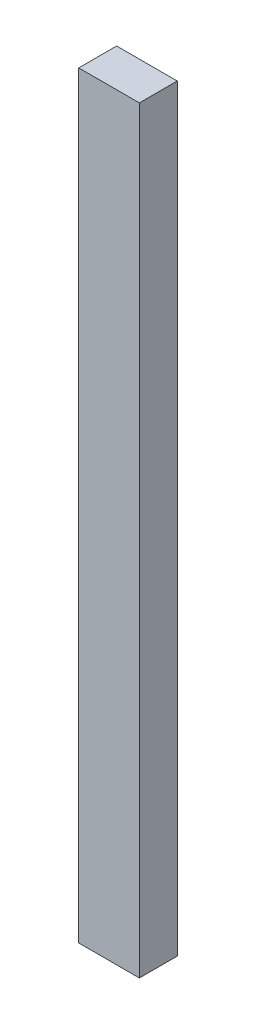
from build123d import *

# Parameters (mm, degrees)
ESQUISSE1_W        = 40
ESQUISSE1_H        = 500
BOSS_EXTRU_1_DEPTH = 25


with BuildPart() as part:
    # Esquisse1 → Boss.-Extru.1 (new body)
    with BuildSketch(Plane.XY):
        with Locations((20, 250)):
            Rectangle(ESQUISSE1_W, ESQUISSE1_H)
    extrude(amount=BOSS_EXTRU_1_DEPTH)


solid = part.part
